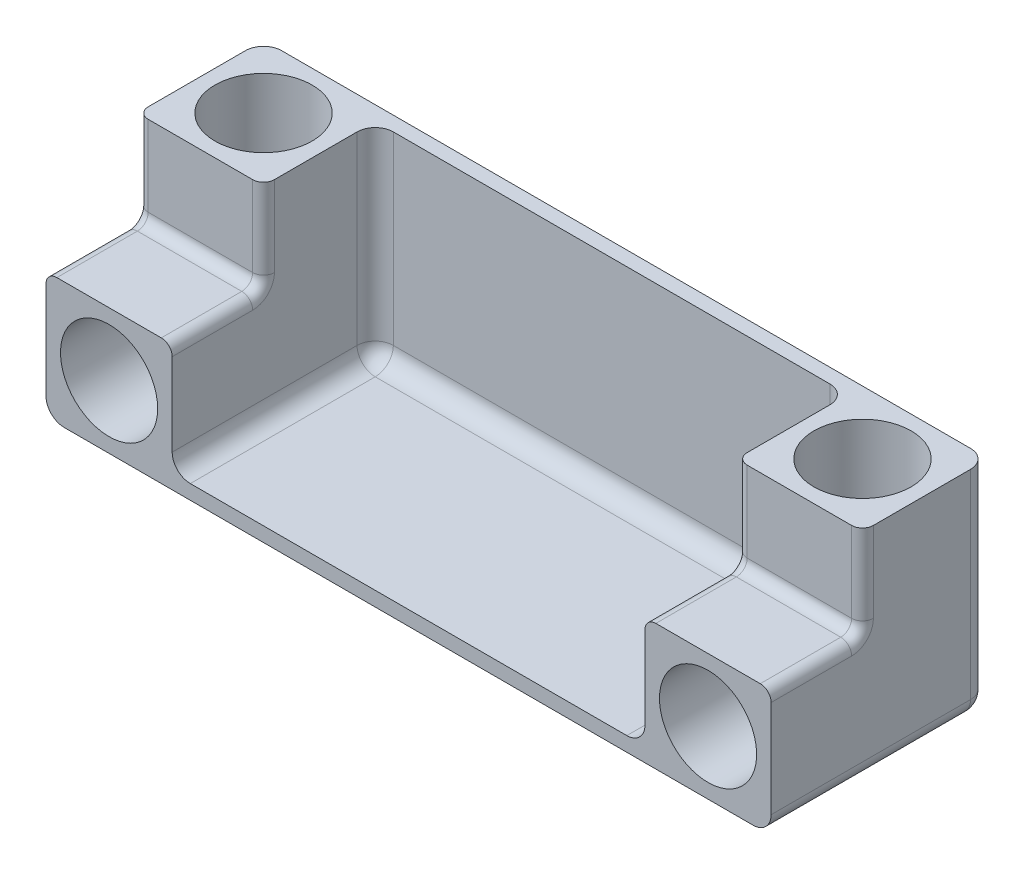
from build123d import *

# Parameters (mm, degrees)
SKETCH1_R           = 13.4
BOSS_EXTRUDE1_DEPTH = 56
SKETCH2_W           = 100
SKETCH2_H           = 60
BOSS_EXTRUDE2_DEPTH = 4
SKETCH3_R           = 13.4
CUT_EXTRUDE1_DEPTH  = 25.2
SKETCH4_W           = 25.2
SKETCH4_H           = 25.2
CUT_EXTRUDE2_DEPTH  = 51.2
FILLET1_R           = 5
FILLET2_R           = 5
FILLET4_R           = 3
FILLET5_R           = 3


with BuildPart() as part:
    # Sketch1 → Boss-Extrude1 (new body)
    with BuildSketch(Plane(origin=(0, 0, 0), x_dir=(1, 0, 0), z_dir=(0, 1, 0))):
        Polygon((-65.2, -11.320132013), (-65.2, 44.679867987), (0, 44.679867987), (0, 48.679867987), (-100, 48.679867987), (-100, -11.320132013), align=None)
        with Locations(Location((-82.6, 31.279867987, 0), (0, 0, 270))):
            Circle(SKETCH1_R, mode=Mode.SUBTRACT)
    boss_extrude1 = extrude(amount=BOSS_EXTRUDE1_DEPTH)

    # Sketch2 → Boss-Extrude2 (add)
    with BuildSketch(Plane(origin=(0, 0, 0), x_dir=(1, 0, 0), z_dir=(0, 1, 0))):
        with Locations((-50, 18.679867987)):
            Rectangle(SKETCH2_W, SKETCH2_H)
    boss_extrude2 = extrude(amount=-BOSS_EXTRUDE2_DEPTH)

    # Sketch3 → Cut-Extrude1 (cut)
    with BuildSketch(Plane.XY.offset(11.320132013)):
        with Locations((-82.6, 13.4)):
            Circle(SKETCH3_R)
    cut_extrude1 = extrude(amount=-CUT_EXTRUDE1_DEPTH, mode=Mode.SUBTRACT)

    # Sketch4 → Cut-Extrude2 (cut)
    with BuildSketch(Plane.ZY.offset(100)):
        with Locations((-1.279867987, 43.4)):
            Rectangle(SKETCH4_W, SKETCH4_H)
    cut_extrude2 = extrude(amount=-CUT_EXTRUDE2_DEPTH, mode=Mode.SUBTRACT)

    # Mirror2: Boss-Extrude1, Boss-Extrude2, Cut-Extrude1, Cut-Extrude2 across plane
    add(boss_extrude1.mirror(Plane.ZY))
    add(boss_extrude2.mirror(Plane.ZY))
    add(cut_extrude1.mirror(Plane.ZY), mode=Mode.SUBTRACT)
    add(cut_extrude2.mirror(Plane.ZY), mode=Mode.SUBTRACT)

    # Fillet1
    fillet1_edges = [part.edges().sort_by_distance(p)[0] for p in [
        (0, 0, -44.679867987),
        (-65.2, 0, -16.679867987),
        (-65.2, 28, -44.679867987),
        (65.2, 0, -16.679867987),
        (65.2, 28, -44.679867987),
    ]]
    fillet(fillet1_edges, radius=FILLET1_R)

    # Fillet2
    fillet2_edges = [part.edges().sort_by_distance(p)[0] for p in [
        (-100, 26, -48.679867987),
        (-100, -4, -18.679867987),
        (0, -4, -48.679867987),
        (100, 26, -48.679867987),
        (100, -4, -18.679867987),
    ]]
    fillet(fillet2_edges, radius=FILLET2_R)

    # Fillet4
    fillet4_edges = [part.edges().sort_by_distance(p)[0] for p in [
        (-65.2, 30.8, -1.279867987),
        (-65.2, 43.4, -13.879867987),
        (-82.6, 30.8, -13.879867987),
        (-100, 43.4, -13.879867987),
        (-100, 30.8, -1.279867987),
    ]]
    fillet(fillet4_edges, radius=FILLET4_R)

    # Fillet5
    fillet5_edges = [part.edges().sort_by_distance(p)[0] for p in [
        (100, 43.4, -13.879867987),
        (82.6, 30.8, -13.879867987),
        (100, 30.8, -1.279867987),
        (65.2, 43.4, -13.879867987),
        (65.2, 30.8, -1.279867987),
    ]]
    fillet(fillet5_edges, radius=FILLET5_R)


solid = part.part
